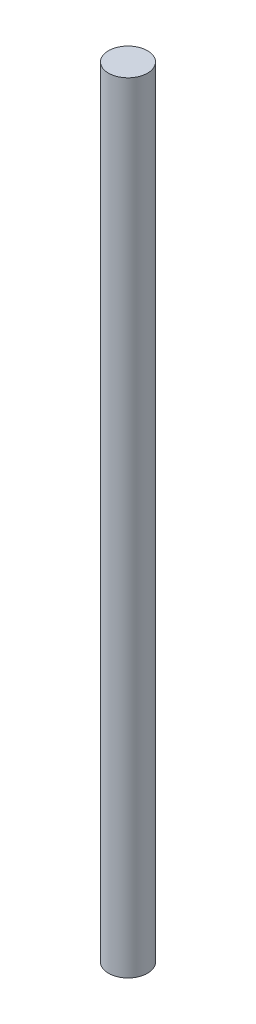
from build123d import *

# Parameters (mm, degrees)
SZKIC1_R                    = 0.5
DODANIE_WYCI_GNI_CIE1_DEPTH = 20


with BuildPart() as part:
    # Szkic1 → Dodanie-wyciągnięcie1 (new body)
    with BuildSketch(Plane(origin=(0, 0, 0), x_dir=(1, 0, 0), z_dir=(0, 1, 0))):
        with Locations(Location((0, 0, 0), (0, 0, 270))):
            Circle(SZKIC1_R)
    extrude(amount=DODANIE_WYCI_GNI_CIE1_DEPTH)


solid = part.part
